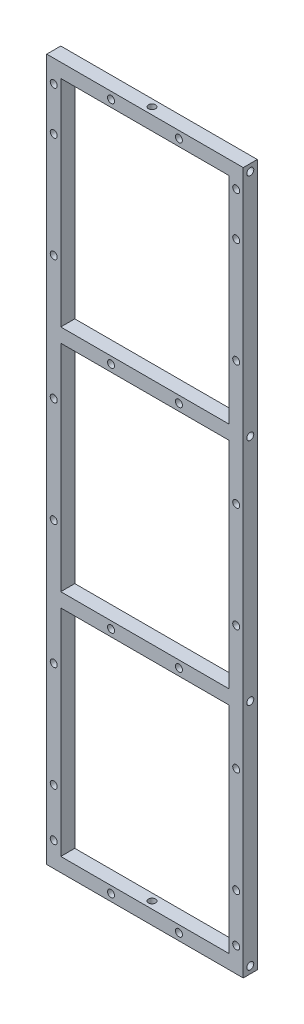
from build123d import *

# Parameters (mm, degrees)
SKETCH1_W           = 84
SKETCH1_H           = 300
SKETCH1_W_2         = 72
SKETCH1_H_2         = 92
BOSS_EXTRUDE1_DEPTH = 6
SKETCH2_R           = 1.5
CUT_EXTRUDE1_DEPTH  = 10
SKETCH3_R           = 1.5
CUT_EXTRUDE2_DEPTH  = 10
SKETCH4_R           = 1.5
CUT_EXTRUDE3_DEPTH  = 10
SKETCH5_R           = 1.5
CUT_EXTRUDE4_DEPTH  = 10


with BuildPart() as part:
    # Sketch1 → Boss-Extrude1 (new body)
    with BuildSketch(Plane.XY):
        Rectangle(SKETCH1_W, SKETCH1_H)
        with Locations((0, 98)):
            Rectangle(SKETCH1_W_2, SKETCH1_H_2, mode=Mode.SUBTRACT)
        with Locations((0, -98)):
            Rectangle(SKETCH1_W_2, SKETCH1_H_2, mode=Mode.SUBTRACT)
        Rectangle(SKETCH1_W_2, SKETCH1_H_2, mode=Mode.SUBTRACT)
    extrude(amount=BOSS_EXTRUDE1_DEPTH)

    # Sketch2 → Cut-Extrude1 (cut)
    with BuildSketch(Plane(origin=(42, 0, 0), x_dir=(0, 0, -1), z_dir=(1, 0, 0))):
        with Locations((-3, 147)):
            Circle(SKETCH2_R)
        with Locations((-3, 49)):
            Circle(SKETCH2_R)
        with Locations((-3, -49)):
            Circle(SKETCH2_R)
        with Locations((-3, -147)):
            Circle(SKETCH2_R)
    cut_extrude1 = extrude(amount=-CUT_EXTRUDE1_DEPTH, mode=Mode.SUBTRACT)

    # Mirror1: Cut-Extrude1 across plane
    add(cut_extrude1.mirror(Plane(origin=(0, 0, 0), x_dir=(0, 0, 1), z_dir=(1, 0, 0))), mode=Mode.SUBTRACT)

    # Sketch3 → Cut-Extrude2 (cut)
    with BuildSketch(Plane.XY.offset(6)):
        with Locations((-39, 140.5)):
            Circle(SKETCH3_R)
        with Locations((39, 140.5)):
            Circle(SKETCH3_R)
        with Locations((39, -139.5)):
            Circle(SKETCH3_R)
        with Locations((-39, -139.5)):
            Circle(SKETCH3_R)
    extrude(amount=-CUT_EXTRUDE2_DEPTH, mode=Mode.SUBTRACT)

    # Sketch4 → Cut-Extrude3 (cut)
    with BuildSketch(Plane.XY.offset(6)):
        with Locations((-14.5, 147)):
            Circle(SKETCH4_R)
        with Locations((14.5, 147)):
            Circle(SKETCH4_R)
        with Locations((14.5, 49)):
            Circle(SKETCH4_R)
        with Locations((-14.5, 49)):
            Circle(SKETCH4_R)
        with Locations((14.5, -49)):
            Circle(SKETCH4_R)
        with Locations((-14.5, -49)):
            Circle(SKETCH4_R)
        with Locations((14.5, -147)):
            Circle(SKETCH4_R)
        with Locations((-14.5, -147)):
            Circle(SKETCH4_R)
        with Locations((-39, 122)):
            Circle(SKETCH4_R)
        with Locations((-39, 77)):
            Circle(SKETCH4_R)
        with Locations((39, 122)):
            Circle(SKETCH4_R)
        with Locations((39, 77)):
            Circle(SKETCH4_R)
        with Locations((39, 24)):
            Circle(SKETCH4_R)
        with Locations((39, -21)):
            Circle(SKETCH4_R)
        with Locations((39, -74)):
            Circle(SKETCH4_R)
        with Locations((39, -119)):
            Circle(SKETCH4_R)
        with Locations((-39, 24)):
            Circle(SKETCH4_R)
        with Locations((-39, -21)):
            Circle(SKETCH4_R)
        with Locations((-39, -74)):
            Circle(SKETCH4_R)
        with Locations((-39, -119)):
            Circle(SKETCH4_R)
    extrude(amount=-CUT_EXTRUDE3_DEPTH, mode=Mode.SUBTRACT)

    # Sketch5 → Cut-Extrude4 (cut)
    with BuildSketch(Plane(origin=(0, 150, 0), x_dir=(1, 0, 0), z_dir=(0, 1, 0))):
        with Locations(Location((0, -3, 0), (0, 0, 270))):
            Circle(SKETCH5_R)
    cut_extrude4 = extrude(amount=-CUT_EXTRUDE4_DEPTH, mode=Mode.SUBTRACT)

    # Mirror2: Cut-Extrude4 across plane
    add(cut_extrude4.mirror(Plane.ZX), mode=Mode.SUBTRACT)


solid = part.part
